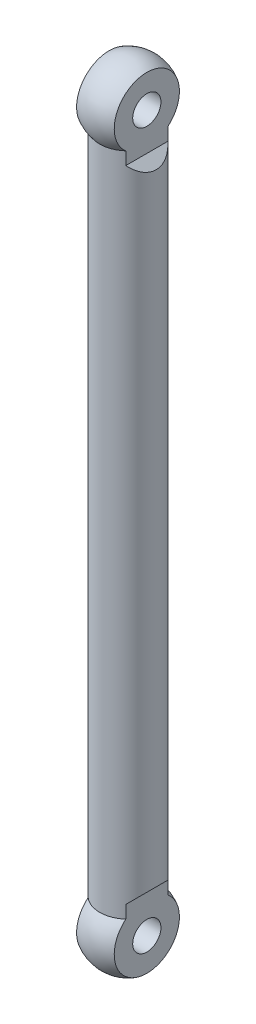
from build123d import *

# Parameters (mm, degrees)
CUT_EXTRUDE_1_DEPTH = 81.199750623
SKETCH_3_R          = 1.5
CUT_EXTRUDE_2_DEPTH = 81.255840909


with BuildPart() as part:
    # 草图1 → 旋转1 (revolve)
    with BuildSketch(Plane(origin=(0, 0, 0), x_dir=(0, 0, -1), z_dir=(1, 0, 0))):
        with BuildLine():
            Line((3, 2.645751311), (3, 73.354248689))
            ThreePointArc((3, 73.354248689), (3.645751311, 77.645751311), (0, 80))
            Line((0, 80), (0, -4))
            ThreePointArc((0, -4), (3.645751311, -1.645751311), (3, 2.645751311))
        make_face()
    revolve(axis=Axis((0, -4, 0), (0, 1, 0)))

    # 草图2 → 切除-拉伸1 (cut, symmetric)
    with BuildSketch(Plane.XY):
        Polygon((2, 81), (2, 72), (3, 71), (8, 71), (8, 81), align=None)
        Polygon((8, -5), (2, -5), (2, 4), (3, 5), (8, 5), align=None)
    cut_extrude_1 = extrude(amount=CUT_EXTRUDE_1_DEPTH, both=True, mode=Mode.SUBTRACT)

    # 镜向1: 切除-拉伸1 across plane
    add(cut_extrude_1.mirror(Plane(origin=(0, 0, 0), x_dir=(0, 0, 1), z_dir=(1, 0, 0))), mode=Mode.SUBTRACT)

    # 草图3 → 切除-拉伸2 (cut, through all)
    with BuildSketch(Plane(origin=(2, 0, 0), x_dir=(0, 0, -1), z_dir=(1, 0, 0))):
        with Locations(Location((0, 76, 0), (0, 0, 90))):
            Circle(SKETCH_3_R)
        with Locations(Location((0, 0, 0), (0, 0, 90))):
            Circle(SKETCH_3_R)
    extrude(amount=-CUT_EXTRUDE_2_DEPTH, mode=Mode.SUBTRACT)


solid = part.part
